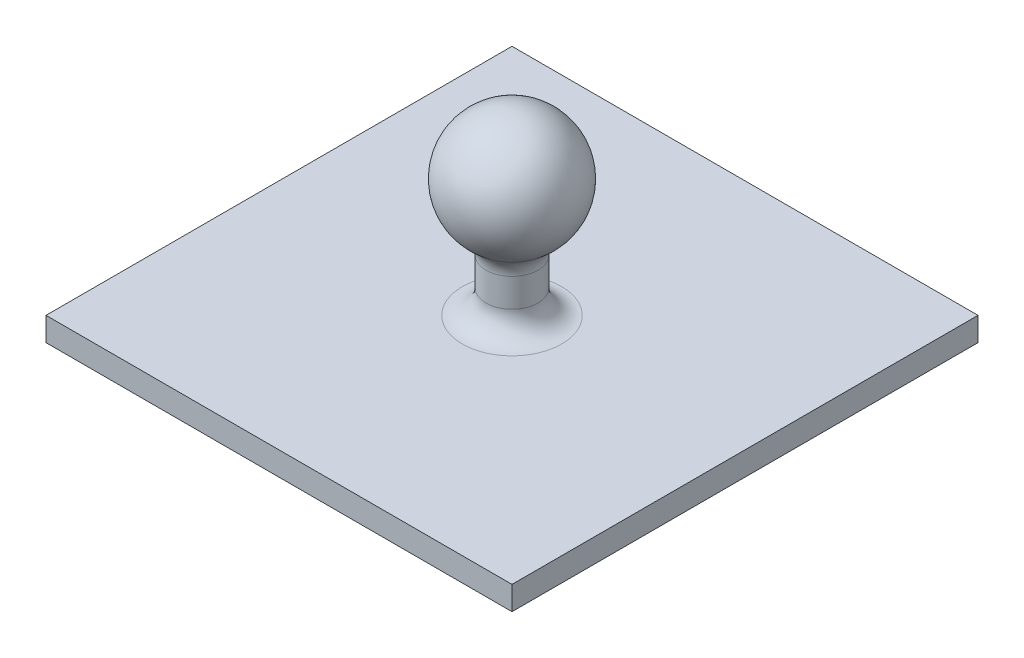
from build123d import *

# Parameters (mm, degrees)
SKETCH2_W           = 100
SKETCH2_H           = 100
BOSS_EXTRUDE1_DEPTH = 5.08
SKETCH3_R           = 5.588
BOSS_EXTRUDE2_DEPTH = 25.4
FILLET1_R           = 5.08


with BuildPart() as part:
    # Sketch2 → Boss-Extrude1 (new body)
    with BuildSketch(Plane(origin=(0, 0, 0), x_dir=(1, 0, 0), z_dir=(0, 1, 0))):
        with Locations((50, 50)):
            Rectangle(SKETCH2_W, SKETCH2_H)
    extrude(amount=BOSS_EXTRUDE1_DEPTH)

    # Sketch3 → Boss-Extrude2 (add)
    with BuildSketch(Plane(origin=(0, 5.08, 0), x_dir=(1, 0, 0), z_dir=(0, 1, 0))):
        with Locations(Location((50, 50, 0), (0, 0, 90))):
            Circle(SKETCH3_R)
    extrude(amount=BOSS_EXTRUDE2_DEPTH)

    # Sketch6 → Revolve1 (revolve)
    with BuildSketch(Plane(origin=(0, 30.48, 0), x_dir=(1, 0, 0), z_dir=(0, 1, 0))):
        with BuildLine():
            Line((50, 62.7), (50, 37.3))
            ThreePointArc((50, 37.3), (62.7, 50), (50, 62.7))
        make_face()
    revolve(axis=Axis((50, 30.48, -62.7), (0, 0, 1)))

    # Fillet1
    fillet1_edges = [part.edges().sort_by_distance(p)[0] for p in [
        (50, 5.08, -44.412),
        (50, 19.075428285, -44.412),
    ]]
    fillet(fillet1_edges, radius=FILLET1_R)


solid = part.part
